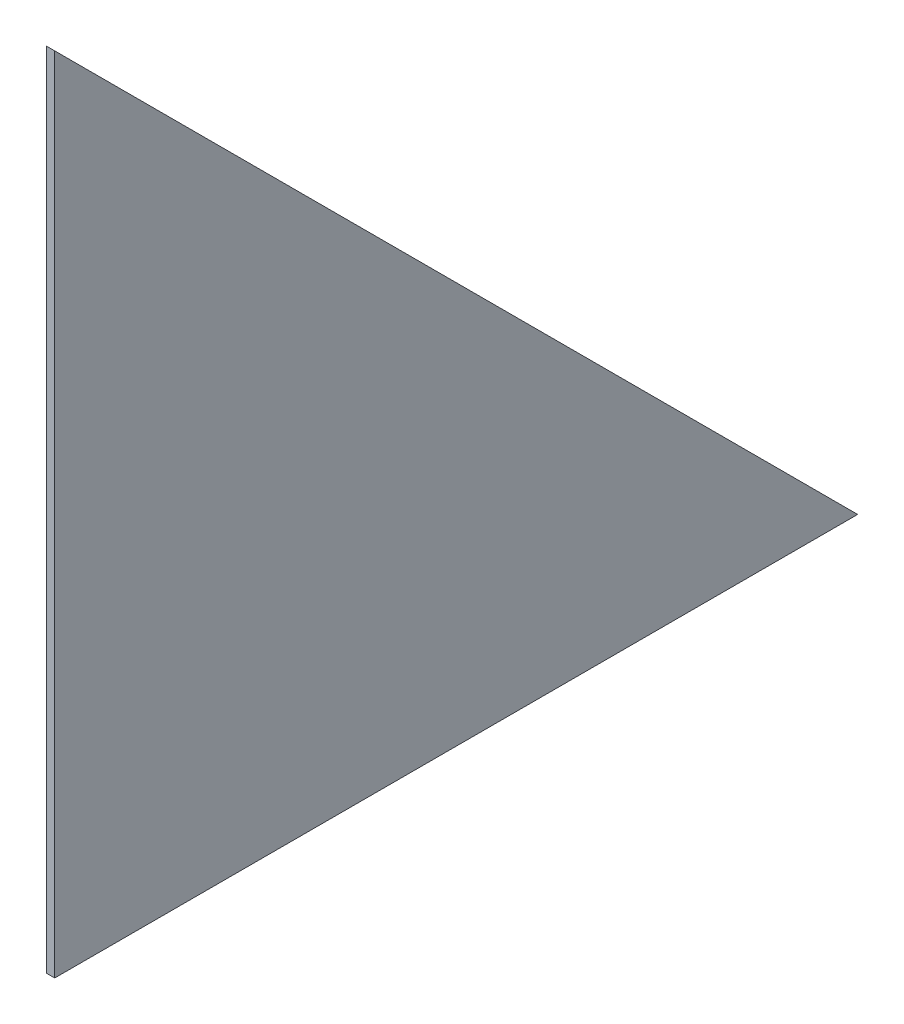
from build123d import *

# Parameters (mm, degrees)
BOSS_EXTRU_1_DEPTH = 4


with BuildPart() as part:
    # Esquisse1 → Boss.-Extru.1 (new body)
    with BuildSketch(Plane(origin=(0, 0, 0), x_dir=(0, 0, -1), z_dir=(1, 0, 0))):
        Polygon((0, 0), (0, 382), (382, 0), align=None)
    extrude(amount=BOSS_EXTRU_1_DEPTH)


solid = part.part
